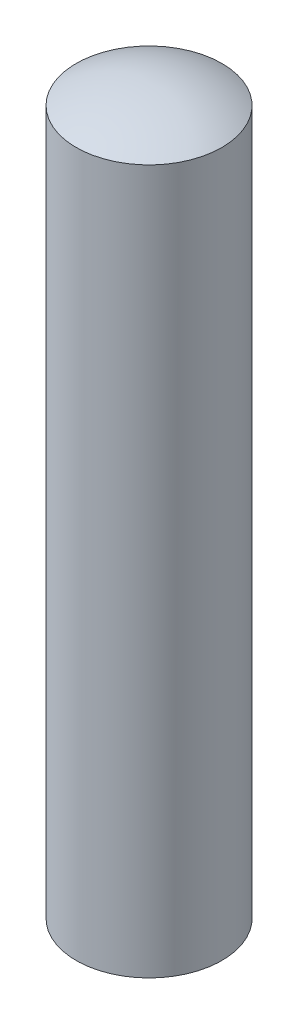
from build123d import *


with BuildPart() as part:
    # Esquisse2 → Base-Révolution (revolve)
    with BuildSketch(Plane.XY, mode=Mode.PRIVATE) as base_r_volution_sk:
        with BuildLine():
            Line((0, -10), (0, 41))
            ThreePointArc((0, 41), (2.588190451, 40.659258263), (5, 39.660254038))
            Line((5, 39.660254038), (5, -8.660254038))
            ThreePointArc((5, -8.660254038), (2.588190451, -9.659258263), (0, -10))
        make_face()
    revolve(base_r_volution_sk.sketch.rotate(Axis((0, -10, 0), (0, 1, 0)), 90), axis=Axis((0, -10, 0), (0, 1, 0)))


solid = part.part
